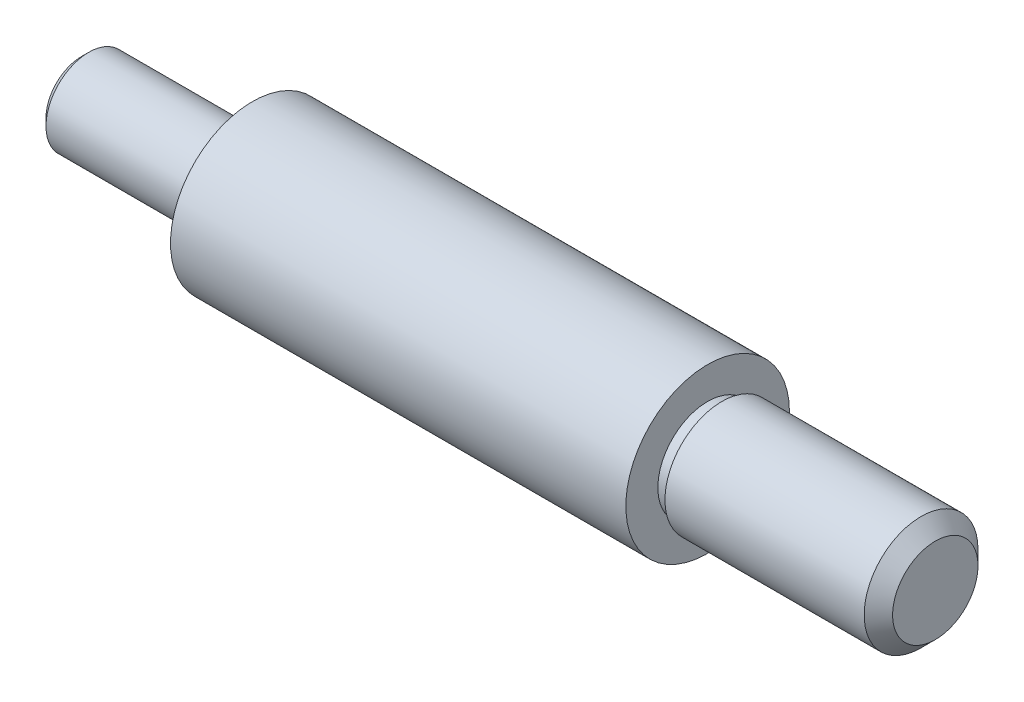
from build123d import *

# Parameters (mm, degrees)
CHAMFER1_SIZE = 2
CHAMFER2_SIZE = 1


with BuildPart() as part:
    # Sketch1 → Revolve1 (revolve)
    with BuildSketch(Plane.XY, mode=Mode.PRIVATE) as revolve1_sk:
        Polygon((0, 0), (30, 0), (30, 8), (0, 8), (0, 7), (-2, 7), (-2, 11.5), (-66, 11.5), (-66, 5), (-68, 5), (-68, 6), (-90, 6), (-90, 0), (-68, 0), (-66, 0), (-2, 0), align=None)
    revolve(revolve1_sk.sketch.rotate(Axis((-68, 0, 0), (-1, 0, 0)), 90), axis=Axis((-68, 0, 0), (-1, 0, 0)))

    # Chamfer1
    chamfer1_edges = [part.edges().sort_by_distance(p)[0] for p in [
        (30, 0, 8),
    ]]
    chamfer(chamfer1_edges, length=CHAMFER1_SIZE)

    # Chamfer2
    chamfer2_edges = [part.edges().sort_by_distance(p)[0] for p in [
        (-90, 0, 6),
    ]]
    chamfer(chamfer2_edges, length=CHAMFER2_SIZE)


solid = part.part
